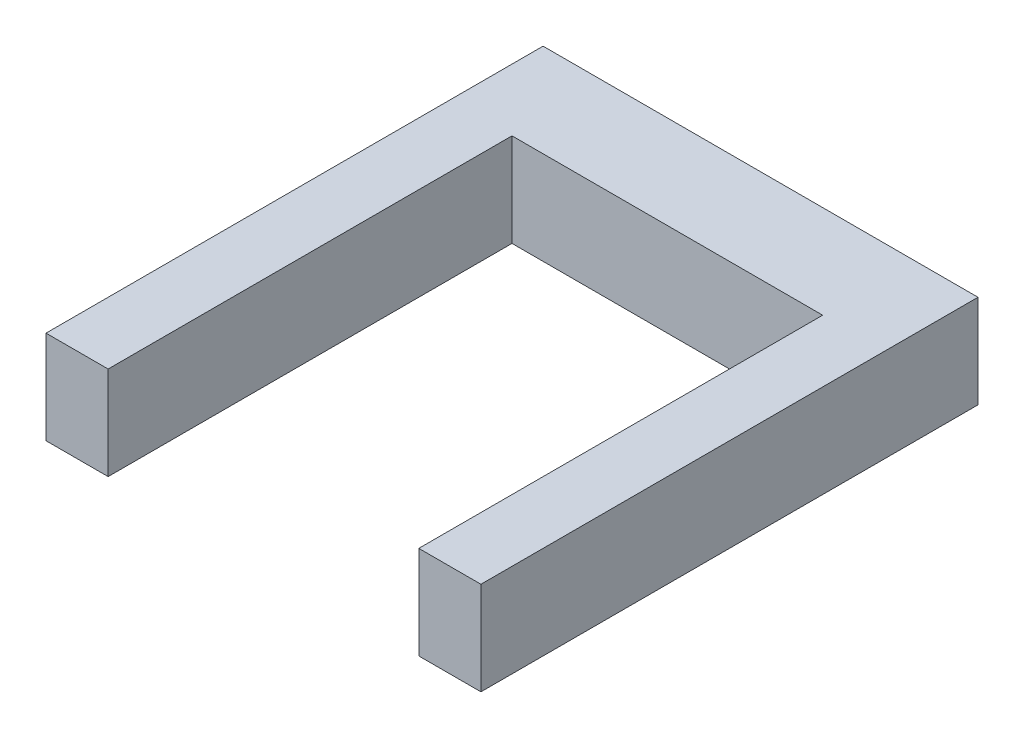
from build123d import *

# Parameters (mm, degrees)
SKETCH1_W           = 711.2
SKETCH1_H           = 812.8
BOSS_EXTRUDE1_DEPTH = 152.4
SKETCH3_W           = 508
SKETCH3_H           = 660.4
CUT_EXTRUDE2_DEPTH  = 562.104339673


with BuildPart() as part:
    # Sketch1 → Boss-Extrude1 (new body)
    with BuildSketch(Plane(origin=(0, 0, 0), x_dir=(1, 0, 0), z_dir=(0, 1, 0))):
        Rectangle(SKETCH1_W, SKETCH1_H)
    extrude(amount=BOSS_EXTRUDE1_DEPTH)

    # Sketch3 → Cut-Extrude2 (cut, through all)
    with BuildSketch(Plane(origin=(0, 152.4, 0), x_dir=(1, 0, 0), z_dir=(0, 1, 0))):
        with Locations((0, -76.2)):
            Rectangle(SKETCH3_W, SKETCH3_H)
    extrude(amount=-CUT_EXTRUDE2_DEPTH, mode=Mode.SUBTRACT)


solid = part.part
